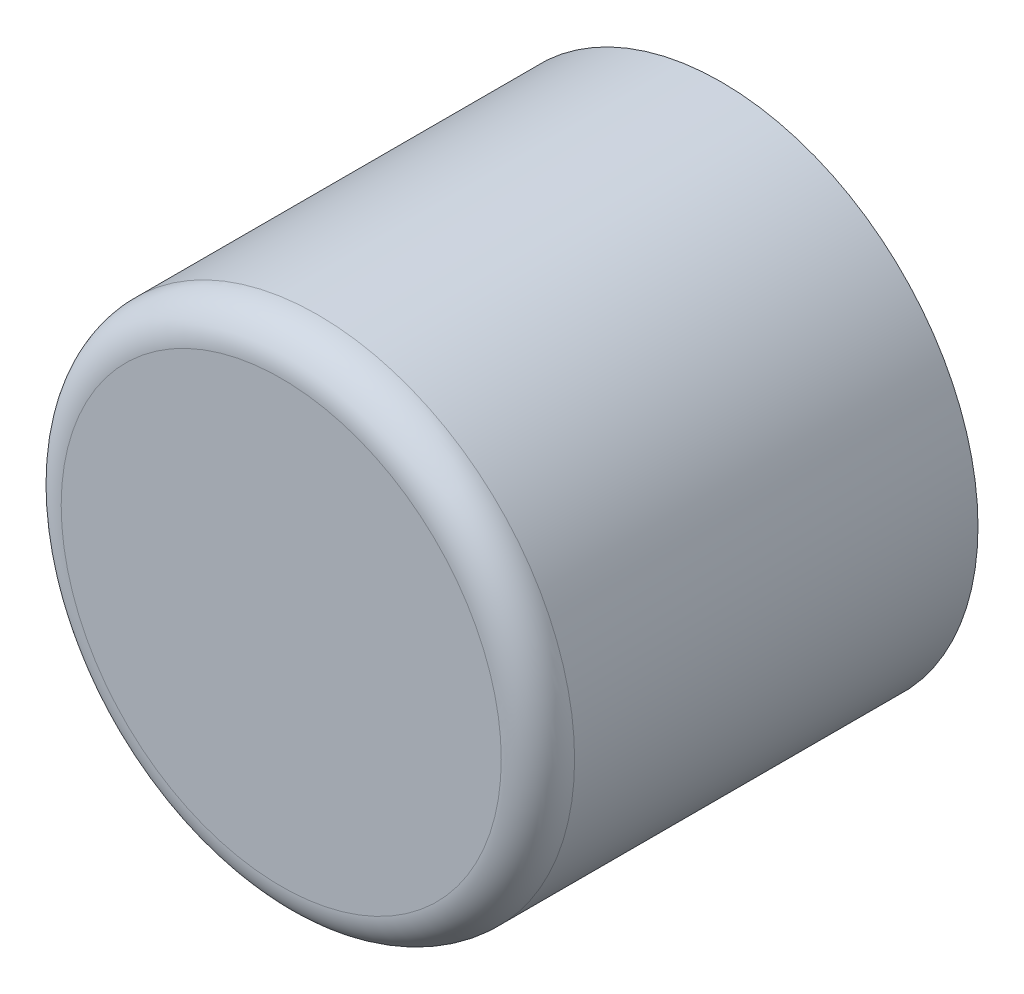
from build123d import *

# Parameters (mm, degrees)
CROQUIS1_R              = 105
CROQUIS1_R_2            = 95
SALIENTE_EXTRUIR1_DEPTH = 180
CROQUIS2_R              = 101.5
SALIENTE_EXTRUIR2_DEPTH = 20
REDONDEO1_R             = 15


with BuildPart() as part:
    # Croquis1 → Saliente-Extruir1 (new body)
    with BuildSketch(Plane.XY):
        with Locations(Location((0, 0, 0), (0, 0, 180))):
            Circle(CROQUIS1_R)
        with Locations(Location((0, 0, 0), (0, 0, 180))):
            Circle(CROQUIS1_R_2, mode=Mode.SUBTRACT)
    extrude(amount=SALIENTE_EXTRUIR1_DEPTH)

    # Croquis2 → Saliente-Extruir2 (add)
    with BuildSketch(Plane.XY.offset(180)):
        Circle(CROQUIS2_R)
    extrude(amount=-SALIENTE_EXTRUIR2_DEPTH)

    # Redondeo1
    redondeo1_edges = [part.edges().sort_by_distance(p)[0] for p in [
        (105, 0, 180),
    ]]
    fillet(redondeo1_edges, radius=REDONDEO1_R)


solid = part.part
